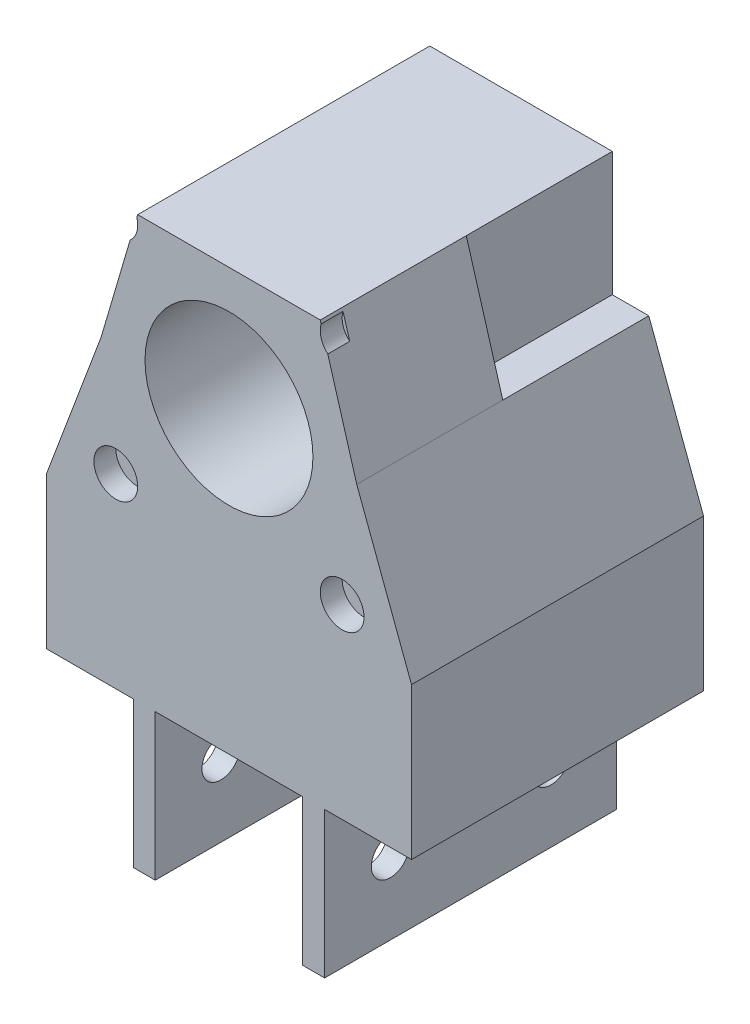
from build123d import *

# Parameters (mm, degrees)
EXTRUDE_1_DEPTH     = 40
SKETCH_2_W          = 25
SKETCH_2_H          = 47
EXTRUDE_2_DEPTH     = 40
HOLE_WIZARD_3_D     = 23
EXTRUDE_3_DEPTH     = 40
EXTRUDE_5_DEPTH     = 20
HOLE_WIZARD_4_D     = 5.2
SKETCH_15_R         = 3
CUT_EXTRUDE_1_DEPTH = 3


with BuildPart() as part:
    # 草图1 → 凸台-拉伸1 (new body)
    with BuildSketch(Plane.XY):
        Polygon((13.1, -5.375), (13.1, -25.375), (10.1, -25.375), (10.1, -5.375), (-10.1, -5.375), (-10.1, -25.375), (-13.1, -25.375), (-13.1, -5.375), (-25, -5.375), (-25, 5.375), (25, 5.375), (25, -5.375), align=None)
    extrude(amount=EXTRUDE_1_DEPTH)

    # 草图2 → 凸台-拉伸2 (add)
    with BuildSketch(Plane(origin=(0, 0, 0), x_dir=(-1, 0, 0), z_dir=(0, 0, -1))):
        with Locations((0, 28.875)):
            Rectangle(SKETCH_2_W, SKETCH_2_H)
    extrude(amount=-EXTRUDE_2_DEPTH)

    # 孔3 (through all)
    with Locations(Plane.XY.offset(40)):
        with Locations((0, 35.625)):
            Hole(HOLE_WIZARD_3_D / 2)

    # 草图10 → 凸台-拉伸3 (add)
    with BuildSketch(Plane.XY.offset(40)):
        Polygon((12.5, 35.375), (17.5, 35.375), (25, 15.375), (25, 5.375), (12.5, 5.375), align=None)
        Polygon((-12.5, 35.375), (-12.5, 5.375), (-25, 5.375), (-25, 15.375), (-17.5, 35.375), align=None)
    extrude(amount=-EXTRUDE_3_DEPTH)

    # 草图12 → 凸台-拉伸5 (add)
    with BuildSketch(Plane.XY.offset(40)):
        Polygon((12.5, 52.375), (17.5, 35.375), (12.5, 35.375), align=None)
        Polygon((-12.5, 52.375), (-17.5, 35.375), (-12.5, 35.375), align=None)
    extrude(amount=-EXTRUDE_5_DEPTH)

    # 孔4 (through all)
    with Locations(Plane(origin=(13.1, 0, 0), x_dir=(0, 0, -1), z_dir=(1, 0, 0))):
        with Locations((-31, -15.375), (-9, -15.375)):
            Hole(HOLE_WIZARD_4_D / 2)

    # 草图15 → 切除-拉伸1 (cut)
    with BuildSketch(Plane.XY.offset(40)):
        with Locations((-15.5, 51.125)):
            Circle(SKETCH_15_R)
        with Locations((15.5, 51.125)):
            Circle(SKETCH_15_R)
        with Locations((-15.5, 20.125)):
            Circle(SKETCH_15_R)
        with Locations((15.5, 20.125)):
            Circle(SKETCH_15_R)
    extrude(amount=-CUT_EXTRUDE_1_DEPTH, mode=Mode.SUBTRACT)


solid = part.part
